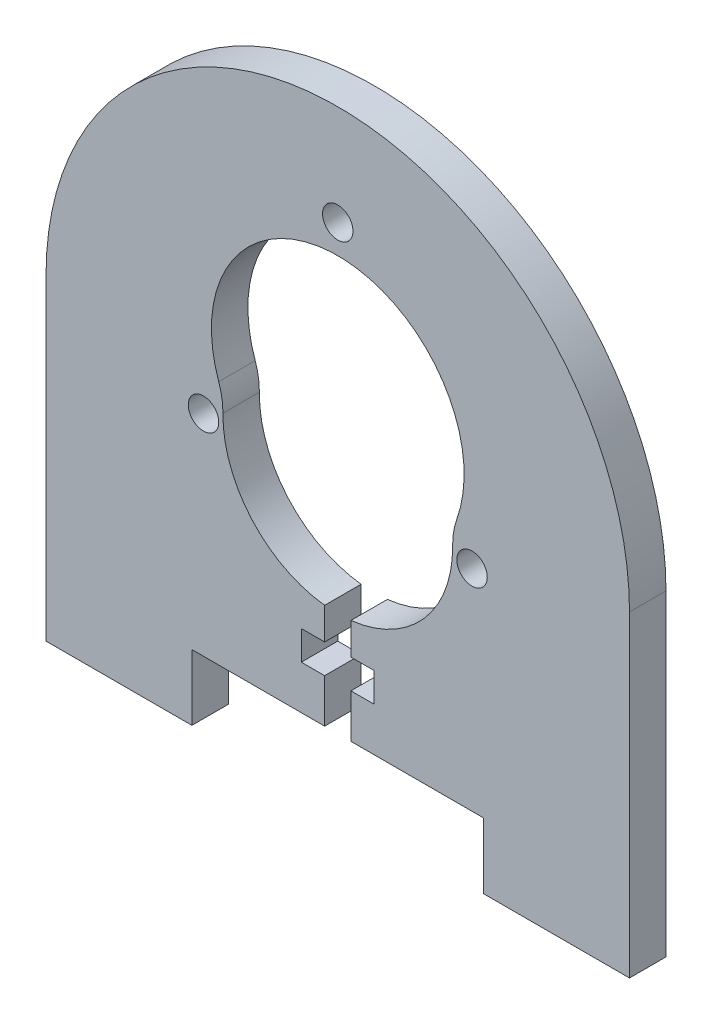
from build123d import *

# Parameters (mm, degrees)
BOSS_EXTRUDE1_DEPTH = 3.175
CUT_EXTRUDE1_REACH  = 48.818
SKETCH2_R           = 11
CUT_EXTRUDE2_REACH  = 48.818
SKETCH3_W           = 25.4
SKETCH3_H           = 5.715
CUT_EXTRUDE4_REACH  = 48.818
SKETCH6_R           = 1.3250037
CUT_EXTRUDE6_DEPTH  = 47.817591721
SKETCH7_R           = 10
CUT_EXTRUDE7_DEPTH  = 47.817591721
FILLET1_R           = 6.35


with BuildPart() as part:
    # Sketch1 → Boss-Extrude1 (new body)
    with BuildSketch(Plane.XY):
        with BuildLine():
            Line((25.4, -13.800079969), (-25.4, -13.800079969))
            Line((-25.4, -13.800079969), (-25.4, 13.800079969))
            ThreePointArc((-25.4, 13.800079969), (0, 39.200079969), (25.4, 13.800079969))
            Line((25.4, 13.800079969), (25.4, -13.800079969))
        make_face()
    extrude(amount=BOSS_EXTRUDE1_DEPTH)

    # Sketch2 → Cut-Extrude1 (cut, up to next)
    with BuildSketch(Plane.XY.offset(3.175), mode=Mode.PRIVATE) as cut_extrude1_sk1:
        with Locations((0, 16.964919969)):
            Circle(SKETCH2_R)
    cut_extrude1_tool1 = extrude(cut_extrude1_sk1.sketch, amount=-CUT_EXTRUDE1_REACH, mode=Mode.PRIVATE) & part.part
    add(cut_extrude1_tool1.solids().sort_by_distance((0, 16.96492, 3.175))[0], mode=Mode.SUBTRACT)

    # Sketch3 → Cut-Extrude2 (cut, up to next)
    with BuildSketch(Plane.XY.offset(3.175), mode=Mode.PRIVATE) as cut_extrude2_sk1:
        with Locations((0, -10.942579969)):
            Rectangle(SKETCH3_W, SKETCH3_H)
    cut_extrude2_tool1 = extrude(cut_extrude2_sk1.sketch, amount=-CUT_EXTRUDE2_REACH, mode=Mode.PRIVATE) & part.part
    add(cut_extrude2_tool1.solids().sort_by_distance((0, -10.94258, 3.175))[0], mode=Mode.SUBTRACT)

    # Sketch5 → Cut-Extrude4 (cut, up to next)
    with BuildSketch(Plane.XY.offset(3.175), mode=Mode.PRIVATE) as cut_extrude4_sk1:
        Polygon((3.175, -4.275079969), (1.143, -4.275079969), (1.143, -8.085079969), (-1.143, -8.085079969), (-1.143, -4.275079969), (-3.175, -4.275079969), (-3.175, -1.735079969), (-1.143, -1.735079969), (-1.143, 7.154920031), (1.143, 7.154920031), (1.143, -1.735079969), (3.175, -1.735079969), align=None)
    cut_extrude4_tool1 = extrude(cut_extrude4_sk1.sketch, amount=-CUT_EXTRUDE4_REACH, mode=Mode.PRIVATE) & part.part
    add(cut_extrude4_tool1.solids().sort_by_distance((0, -1.045651, 3.175))[0], mode=Mode.SUBTRACT)

    # Sketch6 → Cut-Extrude6 (cut, through all)
    with BuildSketch(Plane.XY):
        with Locations((0, 30.464919969)):
            Circle(SKETCH6_R)
        with Locations((11.691342951, 10.214919969)):
            Circle(SKETCH6_R)
        with Locations((-11.691342951, 10.214919969)):
            Circle(SKETCH6_R)
    extrude(amount=CUT_EXTRUDE6_DEPTH, mode=Mode.SUBTRACT)

    # Sketch7 → Cut-Extrude7 (cut, through all)
    with BuildSketch(Plane.XY):
        with Locations((0, 10.964920031)):
            Circle(SKETCH7_R)
    extrude(amount=CUT_EXTRUDE7_DEPTH, mode=Mode.SUBTRACT)

    # Fillet1
    fillet1_edges = [part.edges().sort_by_distance(p)[0] for p in [
        (9.921567423, 12.214919982, 1.5875),
        (-9.921567423, 12.214919982, 1.5875),
    ]]
    fillet(fillet1_edges, radius=FILLET1_R)


solid = part.part
